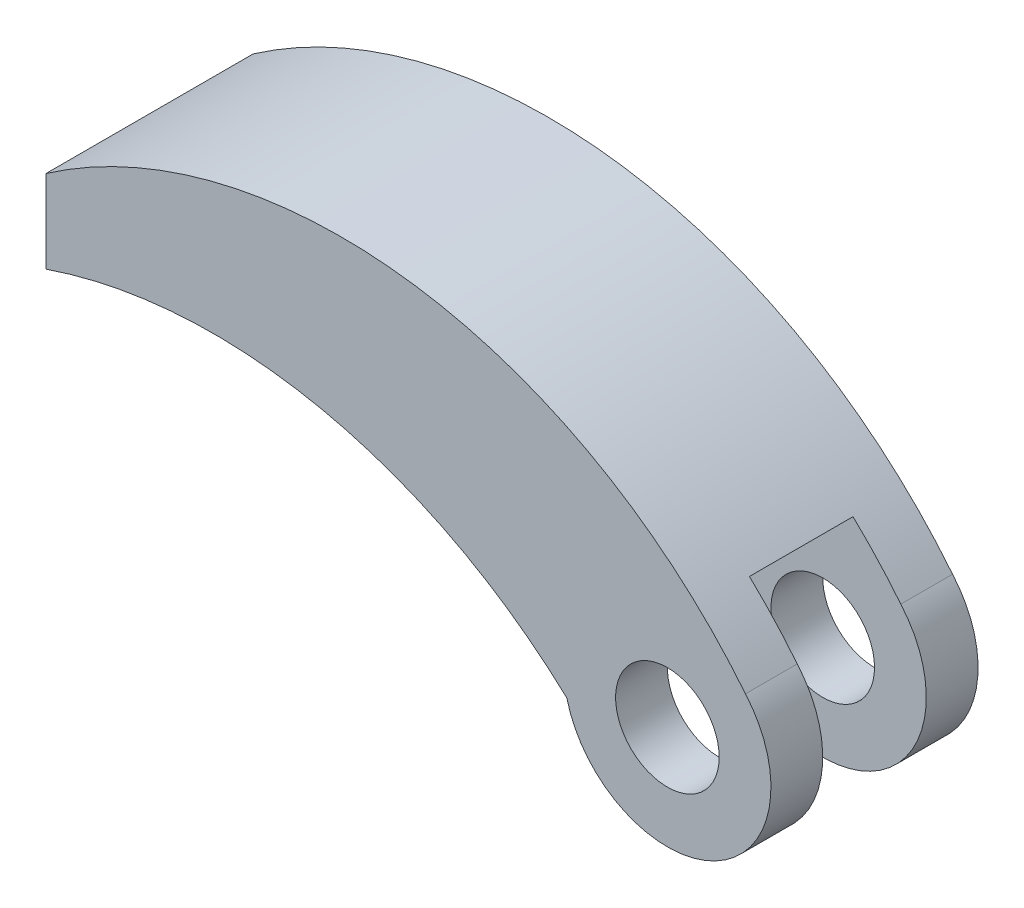
from build123d import *

# Parameters (mm, degrees)
SKETCH1_R               = 5
BOSS_EXTRUDE1_DEPTH     = 10
SKETCH2_R               = 2.5
CUT_EXTRUDE1_DEPTH      = 13.247448714
BOSS_EXTRUDE2_DEPTH     = 10
SKETCH7_R               = 2.5
CUT_EXTRUDE2_DEPTH      = 35.052803759
CUT_EXTRUDE4_DEPTH      = 2.5
CUT_EXTRUDE4_DEPTH_BACK = 2.5
SKETCH15_R              = 10


with BuildPart() as part:
    # Sketch1 → Boss-Extrude1 (new body)
    with BuildSketch(Plane.XY):
        Circle(SKETCH1_R)
    extrude(amount=BOSS_EXTRUDE1_DEPTH)

    # Sketch2 → Cut-Extrude1 (cut, through all)
    with BuildSketch(Plane.XY.offset(10)):
        Circle(SKETCH2_R)
    extrude(amount=-CUT_EXTRUDE1_DEPTH, mode=Mode.SUBTRACT)

    # Sketch6 → Boss-Extrude2 (add)
    with BuildSketch(Plane.XY):
        with BuildLine():
            Line((-30, 8.156486671), (-30, 4.156486671))
            ThreePointArc((-30, 4.156486671), (-16.68023923, 4.957359729), (-4.845860122, -1.207451361))
            Line((-4.845860122, -1.207451361), (3.769015533, 3.285501775))
            ThreePointArc((3.769015533, 3.285501775), (-12.155410699, 12.376939364), (-30, 8.156486671))
        make_face()
    extrude(amount=BOSS_EXTRUDE2_DEPTH)

    # Sketch7 → Cut-Extrude2 (cut, through all)
    with BuildSketch(Plane.XY.offset(10)):
        Circle(SKETCH7_R)
    extrude(amount=-CUT_EXTRUDE2_DEPTH, mode=Mode.SUBTRACT)

    # Sketch15 → Cut-Extrude4 (cut, two sides: drawn at the far end of the back side and taken through both)
    with BuildSketch(Plane.XY.offset(5).offset(-CUT_EXTRUDE4_DEPTH_BACK)):
        with Locations((2.839216425, -4.115683429)):
            Circle(SKETCH15_R)
    extrude(amount=CUT_EXTRUDE4_DEPTH + CUT_EXTRUDE4_DEPTH_BACK, mode=Mode.SUBTRACT)


solid = part.part
